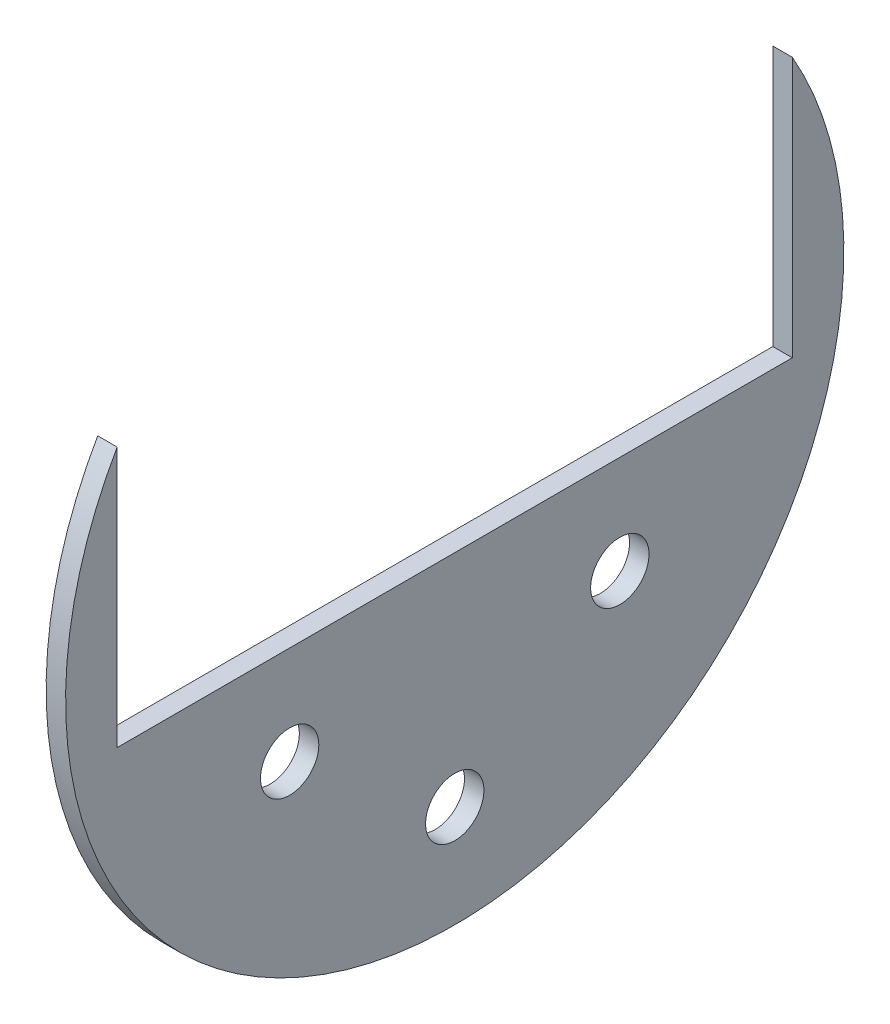
from build123d import *

# Parameters (mm, degrees)
SKETCH1_R           = 20
SKETCH1_R_2         = 1.5
BOSS_EXTRUDE1_DEPTH = 1
SKETCH3_W           = 34.7
SKETCH3_H           = 20.778427125
CUT_EXTRUDE1_DEPTH  = 29.301943396


with BuildPart() as part:
    # Sketch1 → Boss-Extrude1 (new body)
    with BuildSketch(Plane(origin=(0, 0, 0), x_dir=(0, 0, -1), z_dir=(1, 0, 0))):
        Circle(SKETCH1_R)
        with Locations((0, 14.75)):
            Circle(SKETCH1_R_2, mode=Mode.SUBTRACT)
        with Locations((14.75, 0)):
            Circle(SKETCH1_R_2, mode=Mode.SUBTRACT)
        with Locations((0, -14.75)):
            Circle(SKETCH1_R_2, mode=Mode.SUBTRACT)
        with Locations((-14.75, 0)):
            Circle(SKETCH1_R_2, mode=Mode.SUBTRACT)
        with Locations((-8.485281374, 8.485281374)):
            Circle(SKETCH1_R_2, mode=Mode.SUBTRACT)
        with Locations((8.485281374, 8.485281374)):
            Circle(SKETCH1_R_2, mode=Mode.SUBTRACT)
        with Locations((8.485281374, -8.485281374)):
            Circle(SKETCH1_R_2, mode=Mode.SUBTRACT)
        with Locations((-8.485281374, -8.485281374)):
            Circle(SKETCH1_R_2, mode=Mode.SUBTRACT)
    extrude(amount=BOSS_EXTRUDE1_DEPTH)

    # Sketch3 → Cut-Extrude1 (cut, through all)
    with BuildSketch(Plane(origin=(1, 0, 0), x_dir=(0, 0, -1), z_dir=(1, 0, 0))):
        with Locations((0, 6.960786438)):
            Rectangle(SKETCH3_W, SKETCH3_H)
    extrude(amount=-CUT_EXTRUDE1_DEPTH, mode=Mode.SUBTRACT)


with BuildPart() as body_2:
    # of the pieces the cut leaves, the one that is kept (cut_extrude1_keep)
    add(part.part.solids().sort_by_distance((0, 9.948743639, 17.35))[0])


solid = body_2.part
